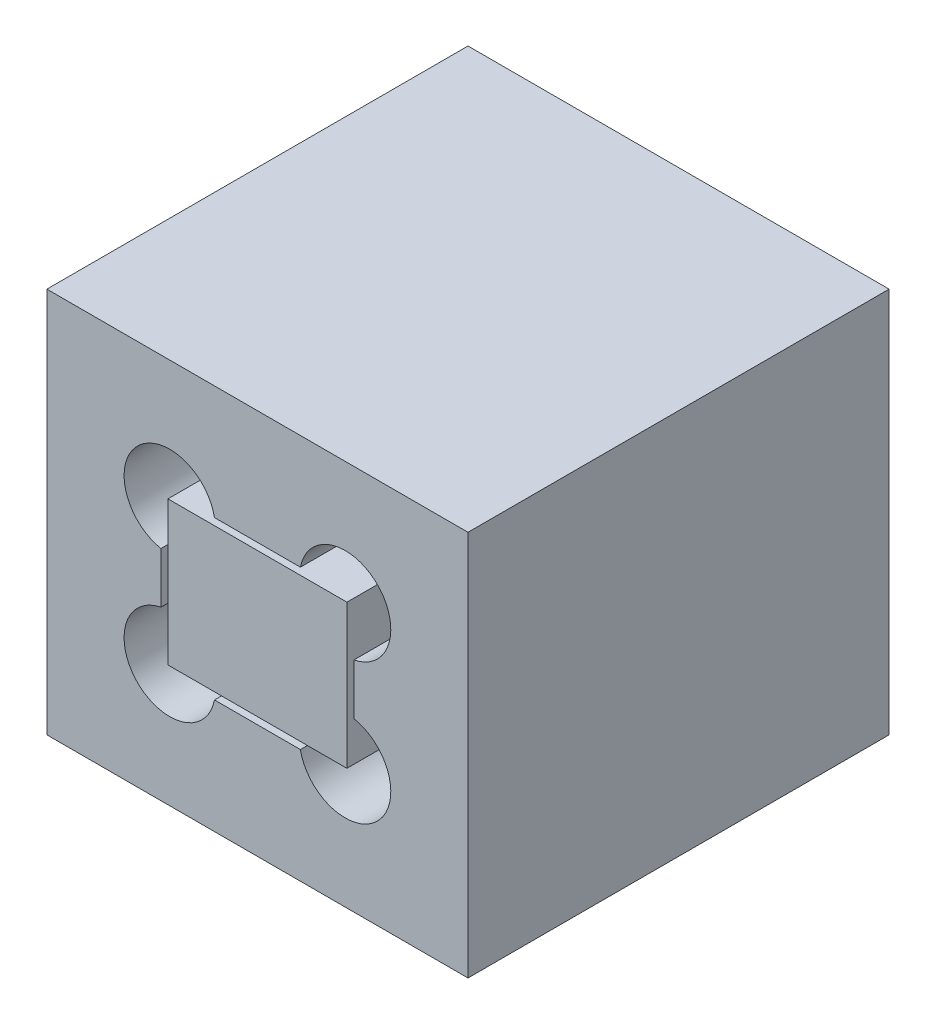
from build123d import *

# Parameters (mm, degrees)
ESQUISSE1_W             = 12
ESQUISSE1_H             = 11
EXTRUSION1_DEPTH        = 12
ENL_V_MAT_EXTRU_1_DEPTH = 2.5
ESQUISSE3_W             = 5.1
ESQUISSE3_H             = 4.1
EXTRUSION2_DEPTH        = 2.5


with BuildPart() as part:
    # Esquisse1 → Extrusion1 (new body)
    with BuildSketch(Plane.XY):
        with Locations((6, 5.5)):
            Rectangle(ESQUISSE1_W, ESQUISSE1_H)
    extrude(amount=EXTRUSION1_DEPTH)

    # Esquisse2 → Enlèv. mat.-Extru.1 (cut)
    with BuildSketch(Plane.XY.offset(12)):
        with BuildLine():
            Line((4.775735082, 7.75), (7.224264918, 7.75))
            ThreePointArc((7.224264918, 7.75), (9.419238816, 8.419238816), (8.75, 6.224264918))
            Line((8.75, 6.224264918), (8.75, 4.775735082))
            ThreePointArc((8.75, 4.775735082), (9.419238816, 2.580761184), (7.224264918, 3.25))
            Line((7.224264918, 3.25), (4.775735082, 3.25))
            ThreePointArc((4.775735082, 3.25), (2.580761184, 2.580761184), (3.25, 4.775735082))
            Line((3.25, 4.775735082), (3.25, 6.224264918))
            ThreePointArc((3.25, 6.224264918), (2.580761184, 8.419238816), (4.775735082, 7.75))
        make_face()
    extrude(amount=-ENL_V_MAT_EXTRU_1_DEPTH, mode=Mode.SUBTRACT)

    # Esquisse3 → Extrusion2 (add)
    with BuildSketch(Plane.XY.offset(9.5)):
        with Locations((6, 5.5)):
            Rectangle(ESQUISSE3_W, ESQUISSE3_H)
    extrude(amount=EXTRUSION2_DEPTH)


solid = part.part
